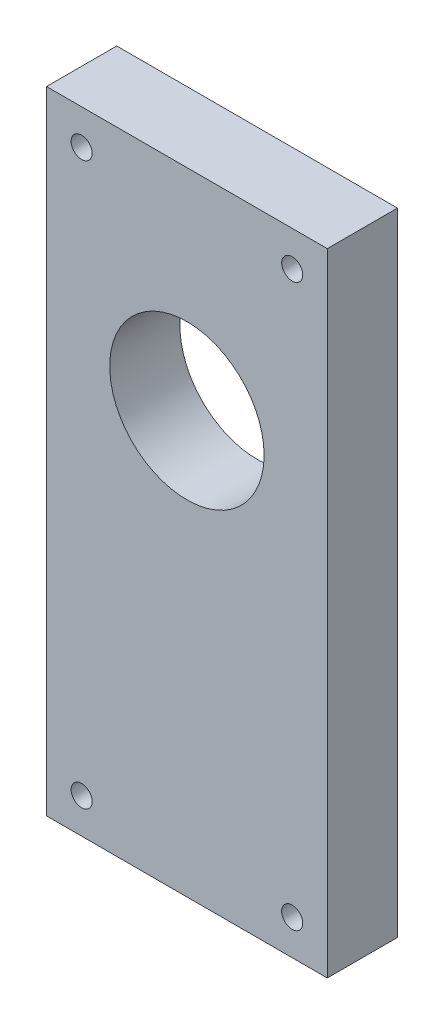
from build123d import *
from build123d.topology import SkipClean

# Parameters (mm, degrees)
SKETCH1_R           = 1.5
BOSS_EXTRUDE1_DEPTH = 10


with BuildPart() as part:
    # Sketch1 → Boss-Extrude1 (new body)
    with BuildSketch(Plane.XY):
        with BuildLine():
            Line((-104.189078903, 39.114814762), (-104.189078903, -50.885185238))
            Line((-104.189078903, -50.885185238), (-84.189078903, -50.885185238))
            Line((-84.189078903, -50.885185238), (-84.189078903, -1.885185238))
            ThreePointArc((-84.189078903, -1.885185238), (-95.189078903, 9.114814762), (-84.189078903, 20.114814762))
            Line((-84.189078903, 20.114814762), (-84.189078903, 39.114814762))
            Line((-84.189078903, 39.114814762), (-104.189078903, 39.114814762))
        make_face()
        with Locations((-99.189078903, -45.885185238)):
            Circle(SKETCH1_R, mode=Mode.SUBTRACT)
        with Locations((-99.189078903, 34.114814762)):
            Circle(SKETCH1_R, mode=Mode.SUBTRACT)
    boss_extrude1 = extrude(amount=BOSS_EXTRUDE1_DEPTH)

    # Mirror1: Boss-Extrude1 across plane
    with SkipClean():  # the faces are left unmerged after this step: merging them gives an invalid solid
        add(boss_extrude1.mirror(Plane(origin=(-84.189078903, 0, 10), x_dir=(0, 0, 1), z_dir=(1, 0, 0))))


solid = part.part
